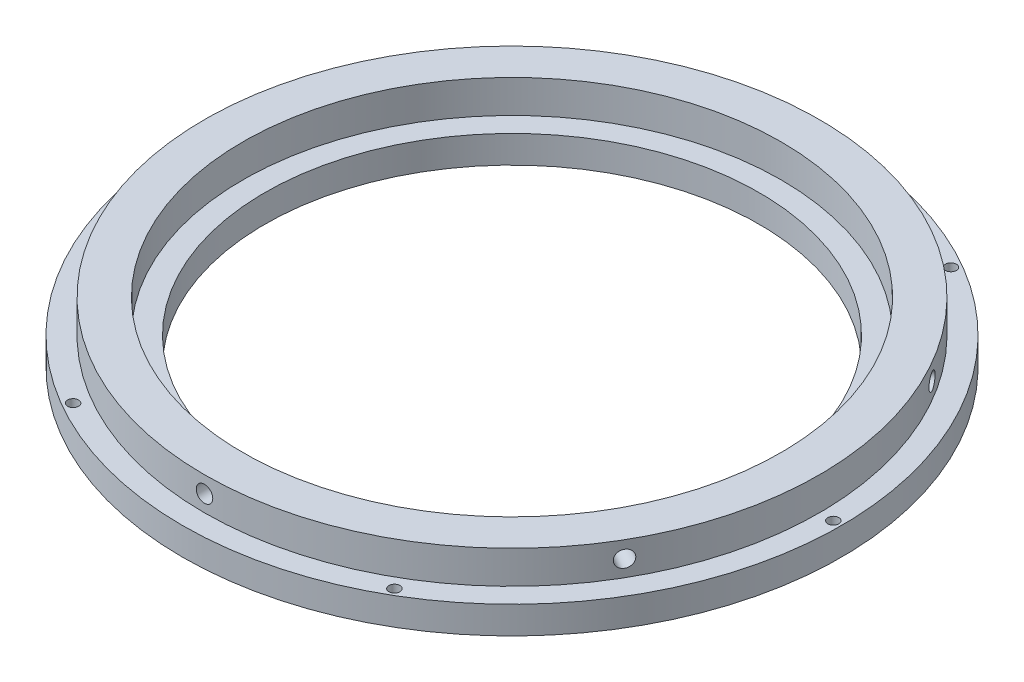
from build123d import *

# Parameters (mm, degrees)
SKETCH1_R           = 76.2
SKETCH1_R_2         = 57.15
BOSS_EXTRUDE1_DEPTH = 6.35
SKETCH2_R           = 71.12
SKETCH2_R_2         = 62.23
BOSS_EXTRUDE2_DEPTH = 7.62
SKETCH4_R           = 1.905
CUT_EXTRUDE1_DEPTH  = 5.08
CIRPATTERN1_COUNT   = 6
SKETCH7_R           = 1.27
CUT_EXTRUDE2_DEPTH  = 2.54


with BuildPart() as part:
    # Sketch1 → Boss-Extrude1 (new body)
    with BuildSketch(Plane(origin=(0, 0, 0), x_dir=(1, 0, 0), z_dir=(0, 1, 0))):
        with Locations(Location((0, 0, 0), (0, 0, 270))):
            Circle(SKETCH1_R)
        with Locations(Location((0, 0, 0), (0, 0, 270))):
            Circle(SKETCH1_R_2, mode=Mode.SUBTRACT)
    extrude(amount=BOSS_EXTRUDE1_DEPTH)

    # Sketch2 → Boss-Extrude2 (add)
    with BuildSketch(Plane(origin=(0, 6.35, 0), x_dir=(1, 0, 0), z_dir=(0, 1, 0))):
        with Locations(Location((0, 0, 0), (0, 0, 90))):
            Circle(SKETCH2_R)
        with Locations(Location((0, 0, 0), (0, 0, 90))):
            Circle(SKETCH2_R_2, mode=Mode.SUBTRACT)
    extrude(amount=BOSS_EXTRUDE2_DEPTH)

    # Sketch4 → Cut-Extrude1 (cut)
    with BuildSketch(Plane.XY.offset(71.12)):
        with Locations((0, 10.16)):
            Circle(SKETCH4_R)
    cut_extrude1 = extrude(amount=-CUT_EXTRUDE1_DEPTH, mode=Mode.SUBTRACT)

    # CirPattern1: Cut-Extrude1 ×6 about axis
    cirpattern1_axis = Axis((0, 0, 0), (0, 1, 0))
    for i in range(1, CIRPATTERN1_COUNT):
        add(cut_extrude1.rotate(cirpattern1_axis, i * 360 / CIRPATTERN1_COUNT), mode=Mode.SUBTRACT)

    # Sketch7 → Cut-Extrude2 (cut)
    with BuildSketch(Plane(origin=(0, 6.35, 0), x_dir=(1, 0, 0), z_dir=(0, 1, 0))):
        with Locations(Location((37.1475, 64.341357374, 0), (0, 0, 270))):
            Circle(SKETCH7_R)
        with Locations(Location((74.295, 0, 0), (0, 0, 270))):
            Circle(SKETCH7_R)
        with Locations(Location((37.1475, -64.341357374, 0), (0, 0, 270))):
            Circle(SKETCH7_R)
        with Locations(Location((-37.1475, -64.341357374, 0), (0, 0, 270))):
            Circle(SKETCH7_R)
        with Locations(Location((-74.295, 0, 0), (0, 0, 270))):
            Circle(SKETCH7_R)
        with Locations(Location((-37.1475, 64.341357374, 0), (0, 0, 270))):
            Circle(SKETCH7_R)
    extrude(amount=-CUT_EXTRUDE2_DEPTH, mode=Mode.SUBTRACT)


solid = part.part
